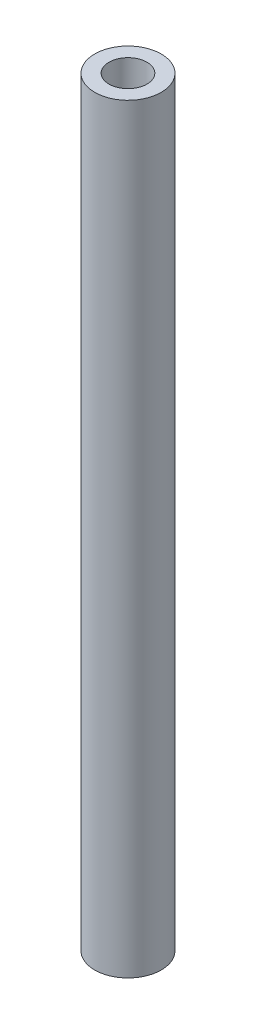
from build123d import *

# Parameters (mm, degrees)
SKETCH_1_R      = 3.5
SKETCH_1_R_2    = 2
EXTRUDE_1_DEPTH = 80


with BuildPart() as part:
    # 草图1 → 凸台-拉伸1 (new body)
    with BuildSketch(Plane(origin=(0, 0, 0), x_dir=(1, 0, 0), z_dir=(0, 1, 0))):
        with Locations(Location((0, 0, 0), (0, 0, 270))):
            Circle(SKETCH_1_R)
        with Locations(Location((0, 0, 0), (0, 0, 270))):
            Circle(SKETCH_1_R_2, mode=Mode.SUBTRACT)
    extrude(amount=EXTRUDE_1_DEPTH)


solid = part.part
